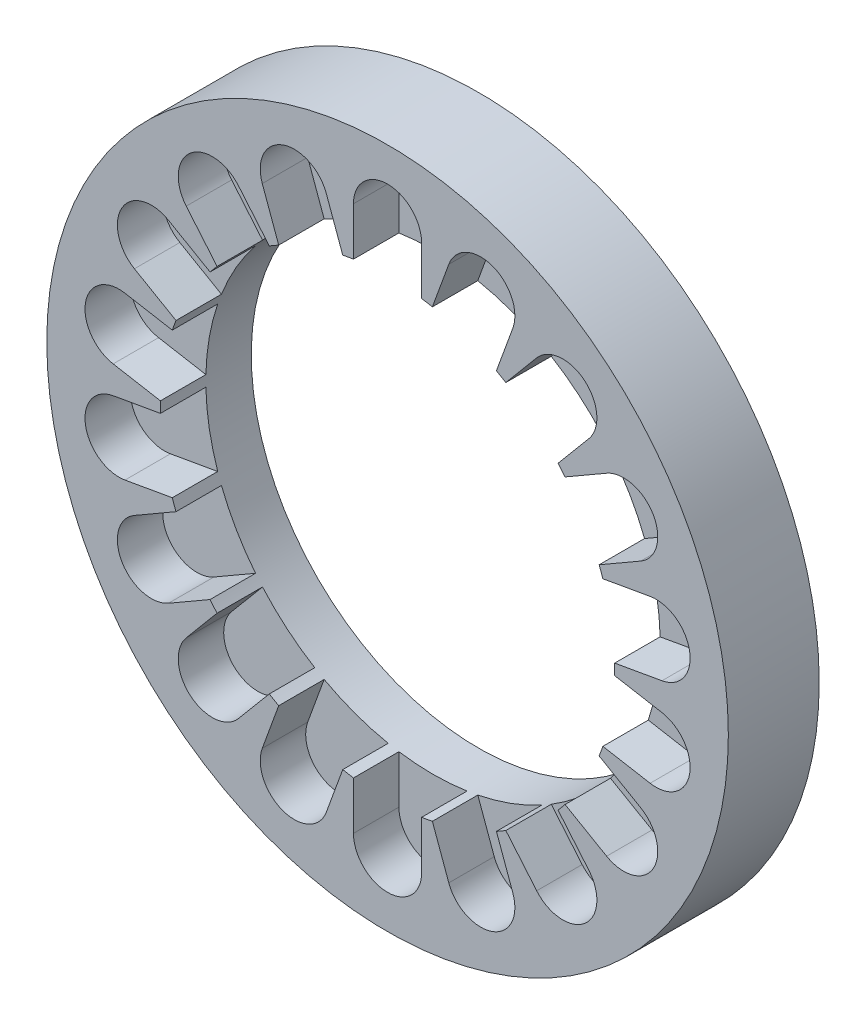
from build123d import *

# Parameters (mm, degrees)
SKETCH1_R           = 190.5
SKETCH1_R_2         = 127
BOSS_EXTRUDE1_DEPTH = 50.8
CUT_EXTRUDE1_DEPTH  = 25.4
CIRPATTERN1_COUNT   = 10
CIRPATTERN1_ANGLE   = 180


with BuildPart() as part:
    # Sketch1 → Boss-Extrude1 (new body)
    with BuildSketch(Plane.XY):
        Circle(SKETCH1_R)
        Circle(SKETCH1_R_2, mode=Mode.SUBTRACT)
    extrude(amount=BOSS_EXTRUDE1_DEPTH)

    # Sketch2 → Cut-Extrude1 (cut)
    with BuildSketch(Plane.XY.offset(50.8)):
        with BuildLine():
            Line((19.05, 152.4), (19.05, -152.4))
            ThreePointArc((19.05, -152.4), (0, -171.45), (-19.05, -152.4))
            Line((-19.05, -152.4), (-19.05, 152.4))
            ThreePointArc((-19.05, 152.4), (0, 171.45), (19.05, 152.4))
        make_face()
    cut_extrude1 = extrude(amount=-CUT_EXTRUDE1_DEPTH, mode=Mode.SUBTRACT)

    # CirPattern1: Cut-Extrude1 ×10 about axis
    cirpattern1_axis = Axis((0, 0, 0), (0, 0, 1))
    for i in range(1, CIRPATTERN1_COUNT):
        add(cut_extrude1.rotate(cirpattern1_axis, i * CIRPATTERN1_ANGLE / (CIRPATTERN1_COUNT - 1)), mode=Mode.SUBTRACT)


solid = part.part
